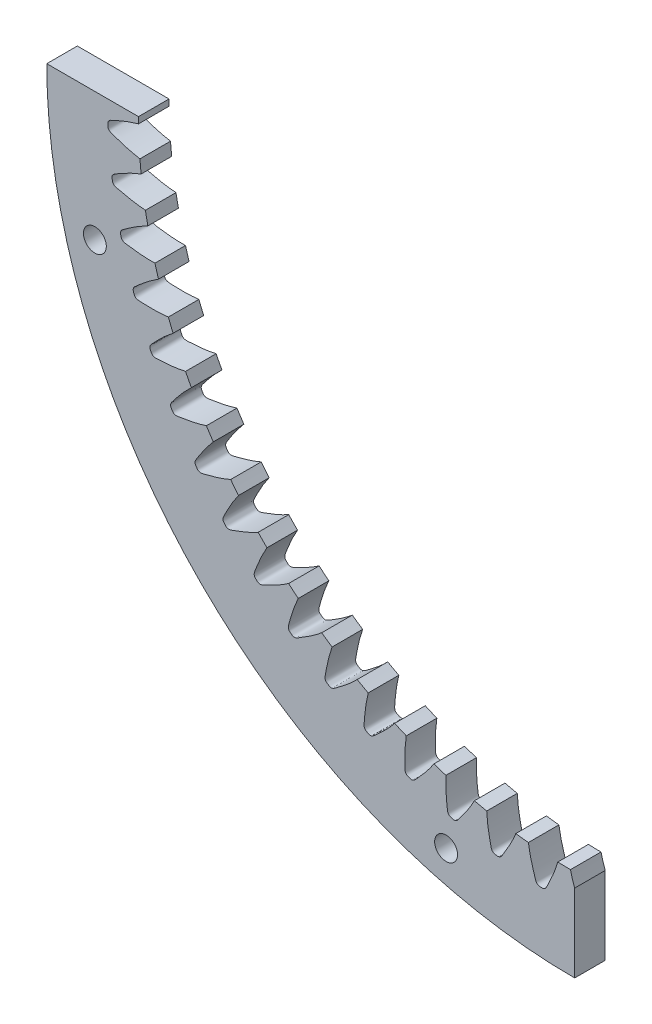
from build123d import *

# Parameters (mm, degrees)
SKETCHREVOLVESPURGEAR_W       = 4
SKETCHREVOLVESPURGEAR_H       = 12
TOOTHEXTRUDECUTSPURGEAR_DEPTH = 5
PATTERNSPURGEAR_COUNT         = 65
CUT_EXTRUDE_2_DEPTH           = 98.772901332
SKETCH_5_R                    = 1.5
CUT_EXTRUDE_3_DEPTH           = 98.772901332


with BuildPart() as part:
    # SketchRevolveSpurGear → SpurGear (revolve)
    with BuildSketch(Plane(origin=(0, 0, 0), x_dir=(0, 0, -1), z_dir=(1, 0, 0))):
        with Locations((3, 63.078)):
            Rectangle(SKETCHREVOLVESPURGEAR_W, SKETCHREVOLVESPURGEAR_H)
    revolve(axis=Axis((0, 0, 0), (0, 0, -1)))

    # SketchToothSpurGear → ToothExtrudeCutSpurGear (cut, symmetric)
    with BuildSketch(Plane.XY):
        with BuildLine():
            ThreePointArc((56.716309071, -2.001030042), (56.75159765, 0), (56.716309071, 2.001030042))
            add(Edge.make_bspline(
                [(56.716309071, 2.001030042), (56.924268076, 1.961368011), (57.248913786, 1.891063044), (57.697185642, 1.778449894), (58.073422272, 1.674735897), (58.475002809, 1.554018424), (58.901487181, 1.415350032), (59.351606276, 1.256439563), (59.827268827, 1.080595406), (60.341850298, 0.857779893), (60.749339319, 0.72969694), (60.967105611, 0.573334715), (61.022499161, 0.517802549), (61.069670168, 0.455222821), (61.107209251, 0.386422556), (61.143738065, 0.289614908), (61.15655669, 0.185123633), (61.15459375, 0.080544385), (61.155203125, 0), (61.15459375, -0.080544385), (61.15655669, -0.185123633), (61.143738065, -0.289614908), (61.107209251, -0.386422556), (61.069670168, -0.455222821), (61.022499161, -0.517802549), (60.967105611, -0.573334715), (60.749339319, -0.72969694), (60.341850298, -0.857779893), (59.827268827, -1.080595406), (59.351606276, -1.256439563), (58.901487181, -1.415350032), (58.475002809, -1.554018424), (58.073422272, -1.674735897), (57.697185642, -1.778449894), (57.248913786, -1.891063044), (56.924268076, -1.961368011), (56.716309071, -2.001030042)],
                knots=[0, 0, 0, 0, 0.061975255, 0.097218658, 0.135299244, 0.176217015, 0.219971969, 0.266564107, 0.315993428, 0.368259933, 0.43123961, 0.438862431, 0.446485251, 0.454108071, 0.461730891, 0.469353711, 0.484283374, 0.492141694, 0.5, 0.507858306, 0.515716626, 0.530646289, 0.538269109, 0.545891929, 0.553514749, 0.561137569, 0.56876039, 0.631740067, 0.684006572, 0.733435893, 0.780028031, 0.823782985, 0.864700756, 0.902781342, 0.938024745, 1, 1, 1, 1], degree=3))
        make_face()
    toothextrudecutspurgear = extrude(amount=TOOTHEXTRUDECUTSPURGEAR_DEPTH, both=True, mode=Mode.SUBTRACT)

    # PatternSpurGear: ToothExtrudeCutSpurGear ×65 about axis
    patternspurgear_axis = Axis((0, 0, 50), (0, 0, -1))
    for i in range(1, PATTERNSPURGEAR_COUNT):
        add(toothextrudecutspurgear.rotate(patternspurgear_axis, i * 360 / PATTERNSPURGEAR_COUNT), mode=Mode.SUBTRACT)

    # Эскиз4 → Вырез-Вытянуть2 (cut, through all)
    with BuildSketch(Plane(origin=(0, 0, -5), x_dir=(-1, 0, 0), z_dir=(0, 0, -1))):
        Polygon((78.803911064, 0), (78.803911064, 98.211582793), (-105.335739058, 98.211582793), (-105.335739058, -72.207470078), (0, -72.207470078), (0, 0), align=None)
    extrude(amount=-CUT_EXTRUDE_2_DEPTH, mode=Mode.SUBTRACT)

    # Эскиз5 → Вырез-Вытянуть3 (cut, through all)
    with BuildSketch(Plane(origin=(0, 0, -5), x_dir=(-1, 0, 0), z_dir=(0, 0, -1))):
        with Locations((16.823237932, -62.785178709)):
            Circle(SKETCH_5_R)
        with Locations((62.785178709, -16.823237932)):
            Circle(SKETCH_5_R)
    extrude(amount=-CUT_EXTRUDE_3_DEPTH, mode=Mode.SUBTRACT)


solid = part.part
